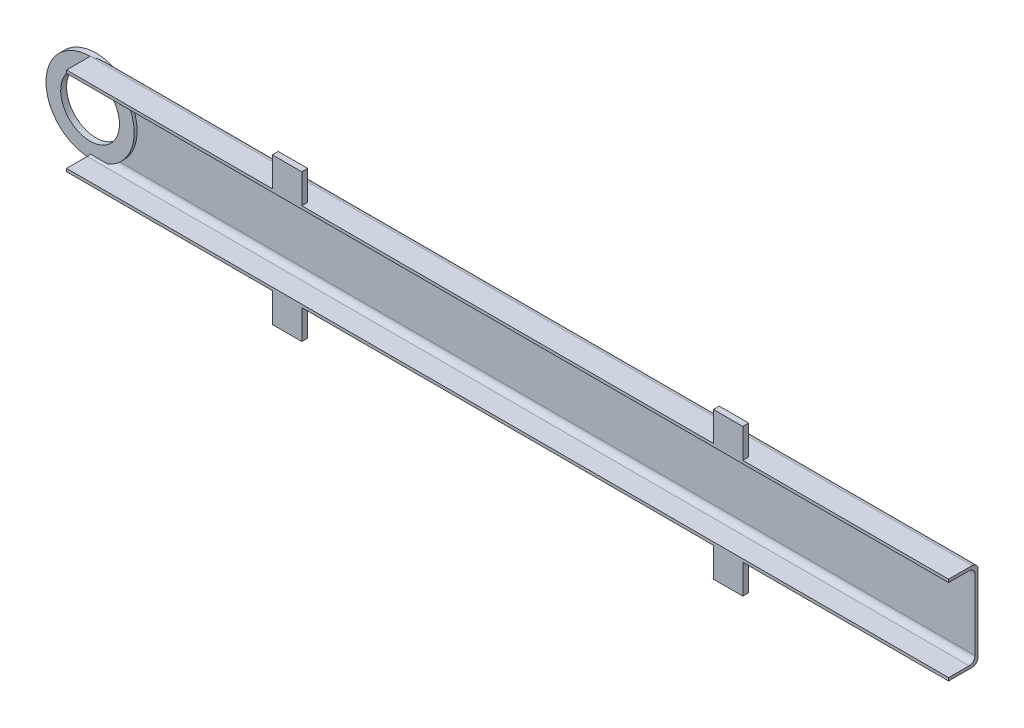
from build123d import *

# Parameters (mm, degrees)
BOSS_EXTRUDE1_DEPTH = 300
SKETCH2_W           = 10
SKETCH2_H           = 10
BOSS_EXTRUDE2_DEPTH = 2
SKETCH4_R           = 15
SKETCH4_R_2         = 10
BOSS_EXTRUDE3_DEPTH = 2
SKETCH4_3_R         = 10
CUT_EXTRUDE1_DEPTH  = 2


with BuildPart() as part:
    # Sketch1 → Boss-Extrude1 (new body)
    with BuildSketch(Plane(origin=(0, 0, 0), x_dir=(0, 0, -1), z_dir=(1, 0, 0))):
        with BuildLine():
            Line((8, 15), (0, 15))
            Line((0, 15), (0, 14))
            Line((0, 14), (7, 14))
            ThreePointArc((7, 14), (8.414213562, 13.414213562), (9, 12))
            Line((9, 12), (9, -12))
            ThreePointArc((9, -12), (8.414213562, -13.414213562), (7, -14))
            Line((7, -14), (0, -14))
            Line((0, -14), (0, -15))
            Line((0, -15), (8, -15))
            ThreePointArc((8, -15), (9.414213562, -14.414213562), (10, -13))
            Line((10, -13), (10, 13))
            ThreePointArc((10, 13), (9.414213562, 14.414213562), (8, 15))
        make_face()
    extrude(amount=BOSS_EXTRUDE1_DEPTH)

    # Sketch2 → Boss-Extrude2 (add)
    with BuildSketch(Plane.XY):
        with Locations((75, 20)):
            Rectangle(SKETCH2_W, SKETCH2_H)
        with Locations((75, -20)):
            Rectangle(SKETCH2_W, SKETCH2_H)
        with Locations((225, 20)):
            Rectangle(SKETCH2_W, SKETCH2_H)
        with Locations((225, -20)):
            Rectangle(SKETCH2_W, SKETCH2_H)
    extrude(amount=-BOSS_EXTRUDE2_DEPTH)

    # Sketch4 → Boss-Extrude3 (add)
    with BuildSketch(Plane(origin=(0, 0, -10), x_dir=(-1, 0, 0), z_dir=(0, 0, -1))):
        Circle(SKETCH4_R)
        Circle(SKETCH4_R_2, mode=Mode.SUBTRACT)
    extrude(amount=-BOSS_EXTRUDE3_DEPTH)

    # Sketch4<3> → Cut-Extrude1 (cut)
    with BuildSketch(Plane(origin=(0, 0, -10), x_dir=(-1, 0, 0), z_dir=(0, 0, -1))):
        Circle(SKETCH4_3_R)
    extrude(amount=-CUT_EXTRUDE1_DEPTH, mode=Mode.SUBTRACT)


solid = part.part
